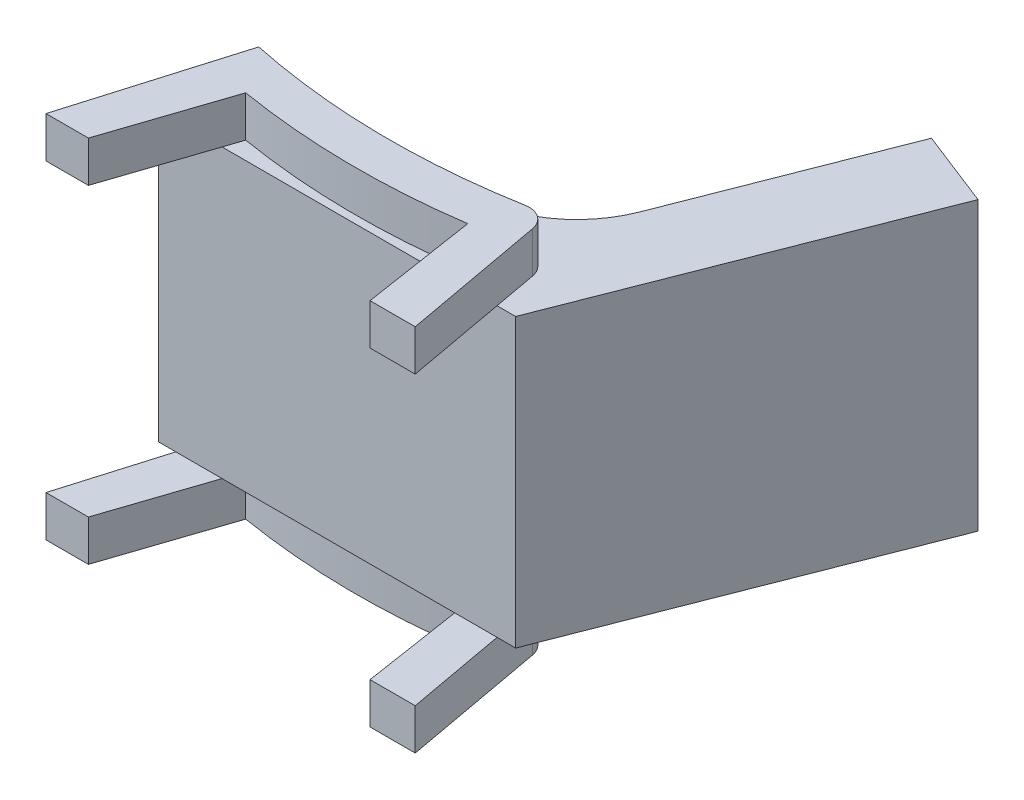
from build123d import *

# Parameters (mm, degrees)
BOSS_EXTRUDE1_DEPTH  = 70
BOSS_EXTRUDE2_DEPTH  = 10
FILLET1_R            = 5
FILLET1_OF_MIRROR1_R = 5


with BuildPart() as part:
    # Sketch1 → Boss-Extrude1 (new body)
    with BuildSketch(Plane(origin=(0, 0, 0), x_dir=(1, 0, 0), z_dir=(0, 1, 0))):
        with BuildLine():
            Line((-61.500129939, 0), (25.499870061, 0))
            Line((25.499870061, 0), (57.174837058, 81.028985343))
            Line((57.174837058, 81.028985343), (38.547484106, 88.310586952))
            Line((38.547484106, 88.310586952), (18.556100358, 37.169837828))
            ThreePointArc((18.556100358, 37.169837828), (8.633917242, 24.701856819), (-6.590826128, 20))
            Line((-6.590826128, 20), (-61.500129939, 20))
            Line((-61.500129939, 20), (-61.500129939, 0))
        make_face()
    extrude(amount=BOSS_EXTRUDE1_DEPTH)

    # Sketch2 → Boss-Extrude2 (add)
    with BuildSketch(Plane(origin=(0, 70, 0), x_dir=(1, 0, 0), z_dir=(0, 1, 0))):
        with BuildLine():
            Line((-52.712841503, 15.588653402), (-64.56499654, -24.411346598))
            Line((-64.56499654, -24.411346598), (-54.23346703, -24.411346598))
            Line((-54.23346703, -24.411346598), (-44.613683261, 4.315907023))
            ThreePointArc((-44.613683261, 4.315907023), (-17.295669473, 1.924485185), (10.065785793, 3.753020511))
            Line((10.065785793, 3.753020511), (14.418892199, -24.411346598))
            Line((14.418892199, -24.411346598), (25.43500346, -24.411346598))
            Line((25.43500346, -24.411346598), (18.121502556, 15.588653402))
            ThreePointArc((18.121502556, 15.588653402), (-17.295669473, 11.924485184), (-52.712841503, 15.588653402))
        make_face()
    boss_extrude2 = extrude(amount=BOSS_EXTRUDE2_DEPTH)

    # Fillet1
    fillet1_edges = [part.edges().sort_by_distance(p)[0] for p in [
        (18.121502556, 75, -15.588653402),
    ]]
    fillet(fillet1_edges, radius=FILLET1_R)

    # Mirror1: Boss-Extrude2 across plane
    add(boss_extrude2.mirror(Plane.ZX.offset(35)))

    # Fillet1 of Mirror1
    fillet1_of_mirror1_edges = [part.edges().sort_by_distance(p)[0] for p in [
        (18.121502556, -5, -15.588653402),
    ]]
    fillet(fillet1_of_mirror1_edges, radius=FILLET1_OF_MIRROR1_R)


solid = part.part
